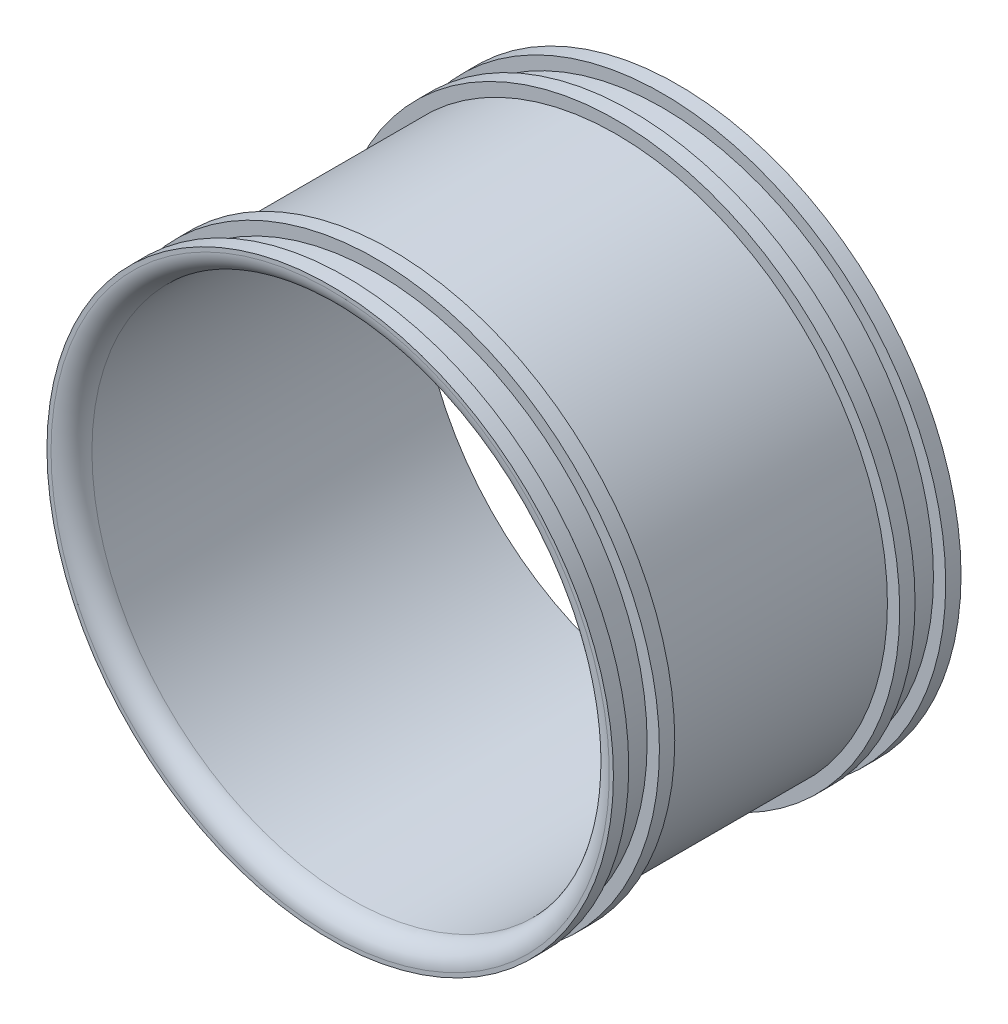
from build123d import *


with BuildPart() as part:
    # Sketch1 → Revolve1 (revolve)
    with BuildSketch(Plane.XZ, mode=Mode.PRIVATE) as revolve1_sk:
        with BuildLine():
            Line((25.3, 0), (27.7, 0))
            Line((27.7, 0), (27.7, 1.5))
            Line((27.7, 1.5), (26.5, 1.5))
            Line((26.5, 1.5), (26.5, 4.5))
            Line((26.5, 4.5), (27.7, 4.5))
            Line((27.7, 4.5), (27.7, 6))
            Line((27.7, 6), (26.5, 6))
            Line((26.5, 6), (26.5, 28))
            Line((26.5, 28), (27.7, 28))
            Line((27.7, 28), (27.7, 29.5))
            Line((27.7, 29.5), (26.5, 29.5))
            Line((26.5, 29.5), (26.5, 32.5))
            Line((26.5, 32.5), (27.7, 32.5))
            Line((27.7, 32.5), (27.7, 34))
            Line((27.7, 34), (27.3, 34))
            ThreePointArc((27.3, 34), (25.885786438, 33.414213562), (25.3, 32))
            Line((25.3, 32), (25.3, 0))
        make_face()
    revolve(revolve1_sk.sketch.rotate(Axis((0, 0, 34), (0, 0, -1)), 180), axis=Axis((0, 0, 34), (0, 0, -1)))


solid = part.part
